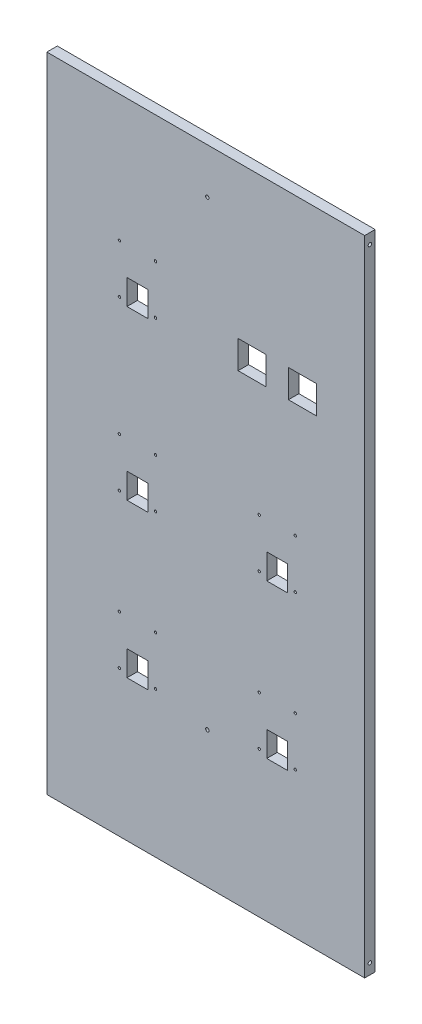
from build123d import *

# Parameters (mm, degrees)
CROQUIS1_W              = 500
CROQUIS1_H              = 920
SALIENTE_EXTRUIR1_DEPTH = 15
CROQUIS2_R              = 2.5
CORTAR_EXTRUIR1_DEPTH   = 524.760441423
CROQUIS3_R              = 2.5
CORTAR_EXTRUIR2_DEPTH   = 680.577074363
CROQUIS5_R              = 1.75
CROQUIS5_W              = 30
CROQUIS5_H              = 36
CORTAR_EXTRUIR3_DEPTH   = 524.760441423
CROQUIS6_W              = 68.576294335
CROQUIS6_H              = 90.214445459
SALIENTE_EXTRUIR2_DEPTH = 15
CROQUIS7_W              = 40
CROQUIS7_H              = 40
CORTAR_EXTRUIR4_DEPTH   = 15
CORTAR_EXTRUIR5_START   = -15
CROQUIS8_W              = 20.35
CROQUIS8_H              = 920
CROQUIS8_W_2            = 24.91
CORTAR_EXTRUIR5_DEPTH   = 15


with BuildPart() as part:
    # Croquis1 → Saliente-Extruir1 (new body)
    with BuildSketch(Plane.XY):
        Rectangle(CROQUIS1_W, CROQUIS1_H)
    extrude(amount=SALIENTE_EXTRUIR1_DEPTH)

    # Croquis2 → Cortar-Extruir1 (cut, through all)
    with BuildSketch(Plane.XY.offset(15)):
        with Locations((0, -265)):
            Circle(CROQUIS2_R)
        with Locations((0, 395)):
            Circle(CROQUIS2_R)
    extrude(amount=-CORTAR_EXTRUIR1_DEPTH, mode=Mode.SUBTRACT)

    # Croquis3 → Cortar-Extruir2 (cut, through all)
    with BuildSketch(Plane(origin=(250, 0, 0), x_dir=(0, 0, -1), z_dir=(1, 0, 0))):
        with Locations((-7.5, 445)):
            Circle(CROQUIS3_R)
        with Locations(Location((-7.5, -445, 0), (0, 0, 180))):
            Circle(CROQUIS3_R)
    extrude(amount=-CORTAR_EXTRUIR2_DEPTH, mode=Mode.SUBTRACT)

    # Croquis5 → Cortar-Extruir3 (cut, through all)
    with BuildSketch(Plane(origin=(0, 0, 0), x_dir=(-1, 0, 0), z_dir=(0, 0, -1))):
        with Locations((-74.2, 208.5)):
            Circle(CROQUIS5_R)
        with Locations((-74.2, 278.5)):
            Circle(CROQUIS5_R)
        with Locations(Location((-125.8, 278.5, 0), (0, 0, 180))):
            Circle(CROQUIS5_R)
        with Locations(Location((-125.8, 208.5, 0), (0, 0, 180))):
            Circle(CROQUIS5_R)
        with Locations((125.8, 208.5)):
            Circle(CROQUIS5_R)
        with Locations((125.8, 278.5)):
            Circle(CROQUIS5_R)
        with Locations(Location((74.2, 278.5, 0), (0, 0, 180))):
            Circle(CROQUIS5_R)
        with Locations(Location((74.2, 208.5, 0), (0, 0, 180))):
            Circle(CROQUIS5_R)
        with Locations((125.8, -31.5)):
            Circle(CROQUIS5_R)
        with Locations((125.8, 38.5)):
            Circle(CROQUIS5_R)
        with Locations(Location((74.2, 38.5, 0), (0, 0, 180))):
            Circle(CROQUIS5_R)
        with Locations(Location((74.2, -31.5, 0), (0, 0, 180))):
            Circle(CROQUIS5_R)
        with Locations((125.8, -251.5)):
            Circle(CROQUIS5_R)
        with Locations((125.8, -181.5)):
            Circle(CROQUIS5_R)
        with Locations(Location((74.2, -181.5, 0), (0, 0, 180))):
            Circle(CROQUIS5_R)
        with Locations(Location((74.2, -251.5, 0), (0, 0, 180))):
            Circle(CROQUIS5_R)
        with Locations((-74.2, -31.5)):
            Circle(CROQUIS5_R)
        with Locations((-74.2, 38.5)):
            Circle(CROQUIS5_R)
        with Locations(Location((-125.8, 38.5, 0), (0, 0, 180))):
            Circle(CROQUIS5_R)
        with Locations(Location((-125.8, -31.5, 0), (0, 0, 180))):
            Circle(CROQUIS5_R)
        with Locations((-74.2, -251.5)):
            Circle(CROQUIS5_R)
        with Locations((-74.2, -181.5)):
            Circle(CROQUIS5_R)
        with Locations(Location((-125.8, -181.5, 0), (0, 0, 180))):
            Circle(CROQUIS5_R)
        with Locations(Location((-125.8, -251.5, 0), (0, 0, 180))):
            Circle(CROQUIS5_R)
        with Locations((100, 220)):
            Rectangle(CROQUIS5_W, CROQUIS5_H)
        with Locations((-100, 220)):
            Rectangle(CROQUIS5_W, CROQUIS5_H)
        with Locations((100, -20)):
            Rectangle(CROQUIS5_W, CROQUIS5_H)
        with Locations((100, -240)):
            Rectangle(CROQUIS5_W, CROQUIS5_H)
        with Locations((-100, -20)):
            Rectangle(CROQUIS5_W, CROQUIS5_H)
        with Locations((-100, -240)):
            Rectangle(CROQUIS5_W, CROQUIS5_H)
    extrude(amount=-CORTAR_EXTRUIR3_DEPTH, mode=Mode.SUBTRACT)

    # Croquis6 → Saliente-Extruir2 (add)
    with BuildSketch(Plane(origin=(0, 0, 0), x_dir=(-1, 0, 0), z_dir=(0, 0, -1))):
        with Locations((-98.305946691, 244.444644428)):
            Rectangle(CROQUIS6_W, CROQUIS6_H)
    extrude(amount=-SALIENTE_EXTRUIR2_DEPTH)

    # Croquis7 → Cortar-Extruir4 (cut)
    with BuildSketch(Plane(origin=(0, 0, 0), x_dir=(-1, 0, 0), z_dir=(0, 0, -1))):
        with Locations((-64, 222)):
            Rectangle(CROQUIS7_W, CROQUIS7_H)
        with Locations((-136, 222)):
            Rectangle(CROQUIS7_W, CROQUIS7_H)
    extrude(amount=-CORTAR_EXTRUIR4_DEPTH, mode=Mode.SUBTRACT)

    # Croquis8 → Cortar-Extruir5 (cut)
    with BuildSketch(Plane(origin=(0, 0, 0), x_dir=(-1, 0, 0), z_dir=(0, 0, -1)).offset(CORTAR_EXTRUIR5_START)):
        with Locations((239.825, 0)):
            Rectangle(CROQUIS8_W, CROQUIS8_H)
        with Locations((-237.545, 0)):
            Rectangle(CROQUIS8_W_2, CROQUIS8_H)
    extrude(amount=CORTAR_EXTRUIR5_DEPTH, mode=Mode.SUBTRACT)


solid = part.part
